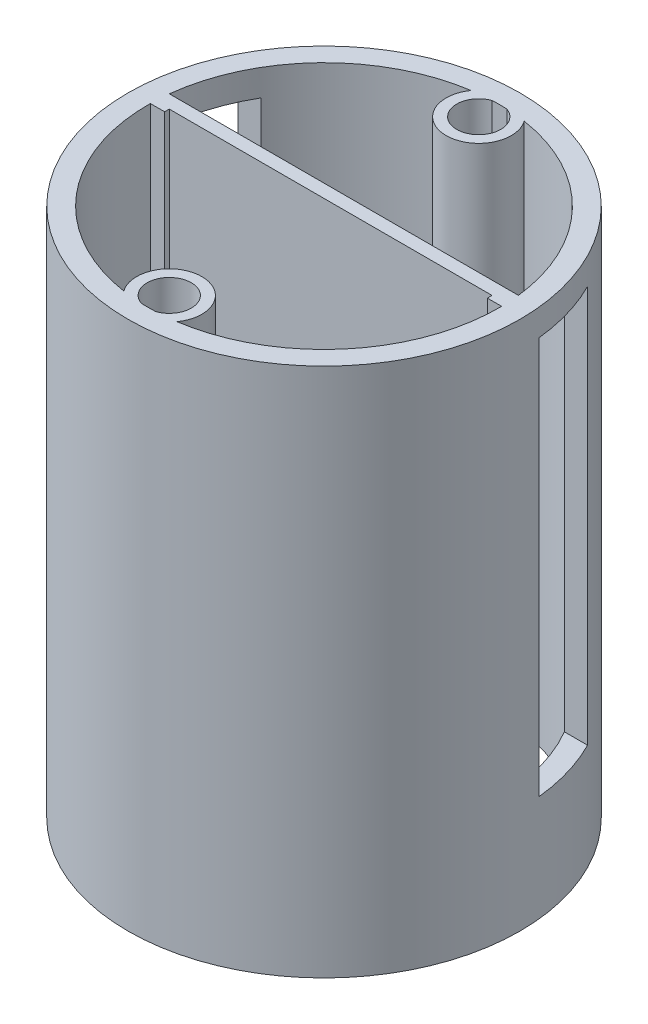
from build123d import *

# Parameters (mm, degrees)
SKETCH1_R               = 37.592
BOSS_EXTRUDE1_DEPTH     = 50.8
SKETCH4_R               = 37.592
BOSS_EXTRUDE2_DEPTH     = 50.8
SKETCH5_R               = 6.25475
SKETCH5_R_2             = 4.22275
BOSS_EXTRUDE3_DEPTH     = 101.6
CUT_EXTRUDE1_DEPTH      = 60.198
CUT_EXTRUDE1_DEPTH_BACK = 64.516
SKETCH6_W               = 13.208
SKETCH6_H               = 76.2


with BuildPart() as part:
    # Sketch1 → Boss-Extrude1 (new body)
    with BuildSketch(Plane(origin=(0, 0, 0), x_dir=(1, 0, 0), z_dir=(0, 1, 0))):
        with Locations(Location((0, 0, 0), (0, 0, 270))):
            Circle(SKETCH1_R)
        with BuildLine():
            Line((-35.143970714, 1.272475327), (-35.143970714, -0.505524673))
            Line((-35.143970714, -0.505524673), (-31.004836055, -0.505524673))
            Line((-31.004836055, -0.505524673), (-31.004836055, -3.045524673))
            Line((-31.004836055, -3.045524673), (-33.544836055, -3.045524673))
            ThreePointArc((-33.544836055, -3.045524673), (0, -33.682803423), (33.544836055, -3.045524673))
            Line((33.544836055, -3.045524673), (31.004836055, -3.045524673))
            Line((31.004836055, -3.045524673), (31.004836055, -0.505524673))
            Line((31.004836055, -0.505524673), (35.143970714, -0.505524673))
            Line((35.143970714, -0.505524673), (35.143970714, 1.272475327))
            Line((35.143970714, 1.272475327), (30.926345458, 1.272475327))
            Line((30.926345458, 1.272475327), (30.926345458, 3.812475327))
            Line((30.926345458, 3.812475327), (33.466345458, 3.812475327))
            ThreePointArc((33.466345458, 3.812475327), (0, 33.682803423), (-33.466345458, 3.812475327))
            Line((-33.466345458, 3.812475327), (-30.926345458, 3.812475327))
            Line((-30.926345458, 3.812475327), (-30.926345458, 1.272475327))
            Line((-30.926345458, 1.272475327), (-35.143970714, 1.272475327))
        make_face(mode=Mode.SUBTRACT)
    extrude(amount=BOSS_EXTRUDE1_DEPTH)

    # Sketch4 → Boss-Extrude2 (add)
    with BuildSketch(Plane(origin=(0, 50.8, 0), x_dir=(1, 0, 0), z_dir=(0, 1, 0))):
        with Locations(Location((0, 0, 0), (0, 0, 270))):
            Circle(SKETCH4_R)
        with BuildLine():
            Line((33.466345458, 3.812475327), (-33.466345458, 3.812475327))
            ThreePointArc((-33.466345458, 3.812475327), (0, 33.682803423), (33.466345458, 3.812475327))
        make_face(mode=Mode.SUBTRACT)
        with BuildLine():
            Line((-30.926345458, 1.272475327), (30.926345458, 1.272475327))
            Line((30.926345458, 1.272475327), (30.965590757, 0.383475327))
            Line((30.965590757, 0.383475327), (33.680620439, 0.383475327))
            ThreePointArc((33.680620439, 0.383475327), (0, -33.682803423), (-33.680620439, 0.383475327))
            Line((-33.680620439, 0.383475327), (-30.965590757, 0.383475327))
            Line((-30.965590757, 0.383475327), (-30.926345458, 1.272475327))
        make_face(mode=Mode.SUBTRACT)
    extrude(amount=BOSS_EXTRUDE2_DEPTH)

    # Sketch5 → Boss-Extrude3 (add)
    # profile 1 of 2: a face of its own
    with BuildSketch(Plane.XZ):
        with Locations((0, -29.670562634)):
            Circle(SKETCH5_R)
        with Locations((0, -29.670562634)):
            Circle(SKETCH5_R_2, mode=Mode.SUBTRACT)
    # profile 2 of 2: a face of its own
    with BuildSketch(Plane.XZ):
        with Locations((0, 29.670562634)):
            Circle(SKETCH5_R)
        with Locations((0, 29.670562634)):
            Circle(SKETCH5_R_2, mode=Mode.SUBTRACT)
    extrude(amount=-BOSS_EXTRUDE3_DEPTH)

    # Sketch6 → Cut-Extrude1 (cut, two sides: drawn at the far end of the back side and taken through both)
    with BuildSketch(Plane(origin=(0, 0, 0), x_dir=(0, 0, -1), z_dir=(1, 0, 0)).offset(-CUT_EXTRUDE1_DEPTH_BACK)):
        with Locations((10.416475327, 58.42)):
            Rectangle(SKETCH6_W, SKETCH6_H)
    extrude(amount=CUT_EXTRUDE1_DEPTH + CUT_EXTRUDE1_DEPTH_BACK, mode=Mode.SUBTRACT)


solid = part.part
